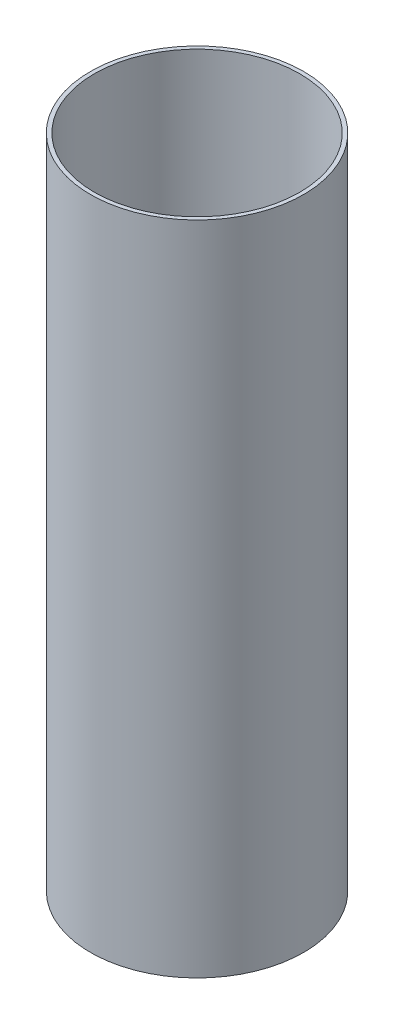
from build123d import *

# Parameters (mm, degrees)
SKETCH2_R           = 49.5046
SKETCH2_R_2         = 47.6885
BOSS_EXTRUDE1_DEPTH = 304.8


with BuildPart() as part:
    # Sketch2 → Boss-Extrude1 (new body)
    with BuildSketch(Plane(origin=(0, 0, 0), x_dir=(1, 0, 0), z_dir=(0, 1, 0))):
        with Locations(Location((0, 0, 0), (0, 0, 90))):
            Circle(SKETCH2_R)
        with Locations(Location((0, 0, 0), (0, 0, 90))):
            Circle(SKETCH2_R_2, mode=Mode.SUBTRACT)
    extrude(amount=BOSS_EXTRUDE1_DEPTH)


solid = part.part
